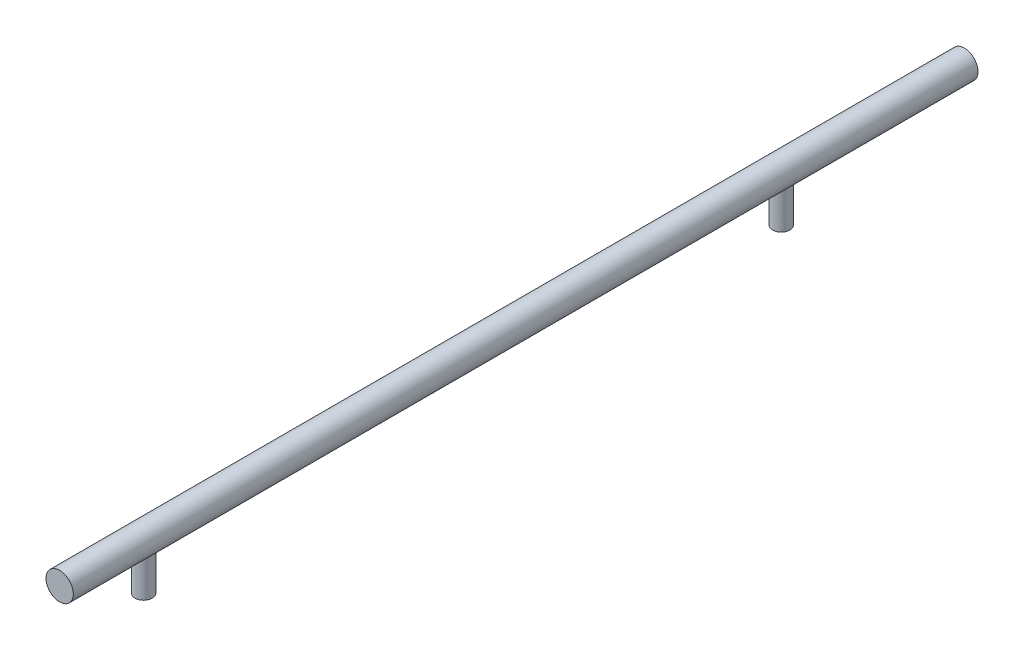
from build123d import *

# Parameters (mm, degrees)
SKETCH1_R           = 3.175
BOSS_EXTRUDE1_DEPTH = 210
BOSS_EXTRUDE2_START = -11.175
SKETCH2_R           = 2
BOSS_EXTRUDE2_DEPTH = 9.175


with BuildPart() as part:
    # Sketch1 → Boss-Extrude1 (new body)
    with BuildSketch(Plane.XY):
        Circle(SKETCH1_R)
    extrude(amount=BOSS_EXTRUDE1_DEPTH)

    # Sketch2 → Boss-Extrude2 (add)
    with BuildSketch(Plane(origin=(0, 0, 0), x_dir=(1, 0, 0), z_dir=(0, 1, 0)).offset(BOSS_EXTRUDE2_START)):
        with Locations(Location((0, -42.5, 0), (0, 0, 90))):
            Circle(SKETCH2_R)
        with Locations(Location((0, -190.5, 0), (0, 0, 90))):
            Circle(SKETCH2_R)
    extrude(amount=BOSS_EXTRUDE2_DEPTH)


solid = part.part
